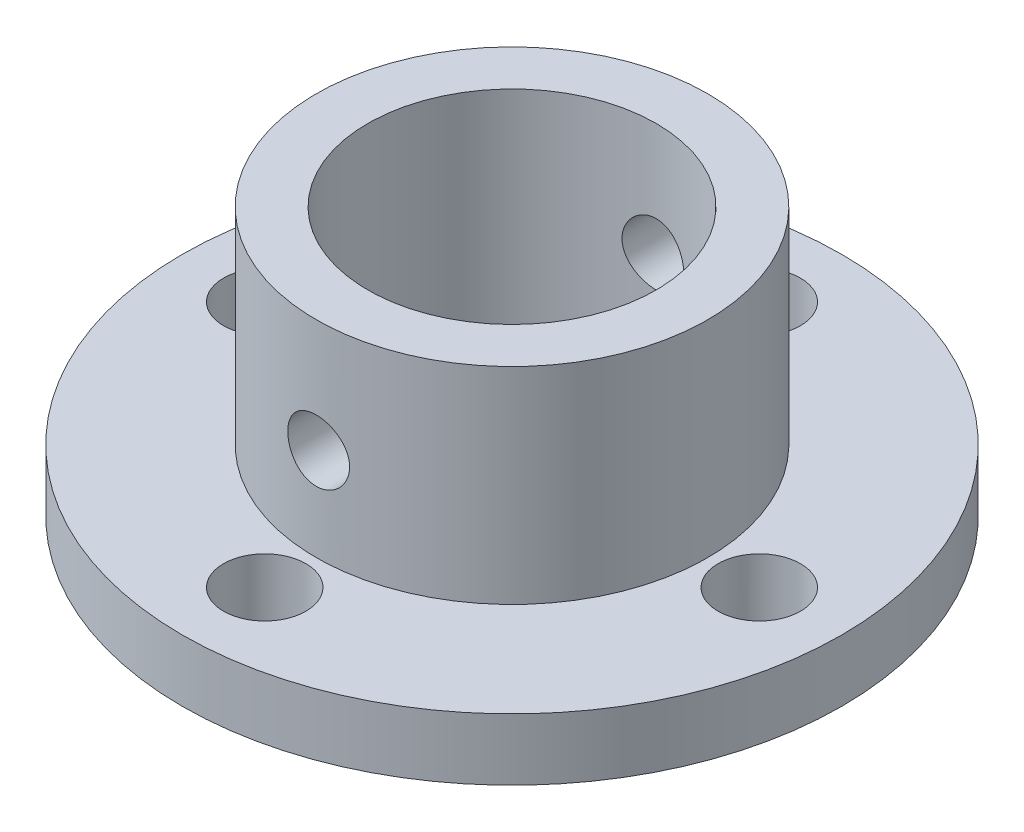
from build123d import *

# Parameters (mm, degrees)
CUT_EXTRUDE1_DEPTH      = 27.095976701
CUT_EXTRUDE1_DEPTH_BACK = 27.095976701
SKETCH2_R               = 1.5
SKETCH3_R               = 2
CUT_EXTRUDE2_DEPTH      = 25.738633794
CIRPATTERN1_COUNT       = 4


with BuildPart() as part:
    # Sketch1 → Revolve1 (revolve)
    with BuildSketch(Plane(origin=(0, 0, 0), x_dir=(0, 0, -1), z_dir=(1, 0, 0)), mode=Mode.PRIVATE) as revolve1_sk:
        Polygon((-7, 0), (-16, 0), (-16, 3), (-9.5, 3), (-9.5, 13), (-7, 13), align=None)
    revolve(revolve1_sk.sketch.rotate(Axis((0, 0, 0), (0, 1, 0)), 180), axis=Axis((0, 0, 0), (0, 1, 0)))

    # Sketch2 → Cut-Extrude1 (cut, two sides: drawn at the far end of the back side and taken through both)
    with BuildSketch(Plane.XY.offset(-CUT_EXTRUDE1_DEPTH_BACK)):
        with Locations((0, 7.5)):
            Circle(SKETCH2_R)
    extrude(amount=CUT_EXTRUDE1_DEPTH + CUT_EXTRUDE1_DEPTH_BACK, mode=Mode.SUBTRACT)

    # Sketch3 → Cut-Extrude2 (cut, symmetric)
    with BuildSketch(Plane(origin=(0, 3, 0), x_dir=(1, 0, 0), z_dir=(0, 1, 0))):
        with Locations(Location((0, -12, 0), (0, 0, 270))):
            Circle(SKETCH3_R)
    cut_extrude2 = extrude(amount=CUT_EXTRUDE2_DEPTH, both=True, mode=Mode.SUBTRACT)

    # CirPattern1: Cut-Extrude2 ×4 about axis
    cirpattern1_axis = Axis((0, 0, 0), (0, 1, 0))
    for i in range(1, CIRPATTERN1_COUNT):
        add(cut_extrude2.rotate(cirpattern1_axis, i * 360 / CIRPATTERN1_COUNT), mode=Mode.SUBTRACT)


solid = part.part
